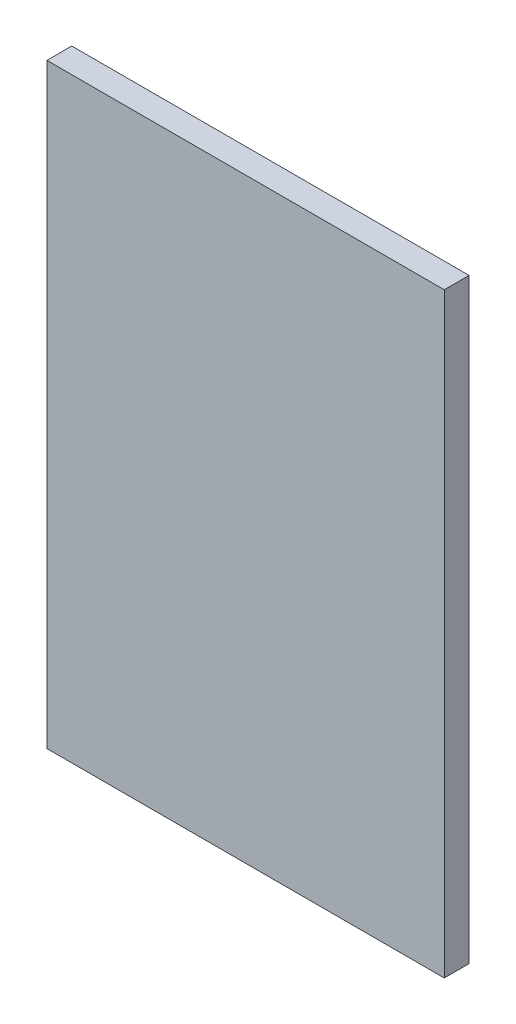
from build123d import *

# Parameters (mm, degrees)
SKETCH1_W           = 50.8
SKETCH1_H           = 76.2
BOSS_EXTRUDE1_DEPTH = 3.175


with BuildPart() as part:
    # Sketch1 → Boss-Extrude1 (new body)
    with BuildSketch(Plane.XY):
        with Locations((25.4, -38.1)):
            Rectangle(SKETCH1_W, SKETCH1_H)
    extrude(amount=BOSS_EXTRUDE1_DEPTH)


solid = part.part
